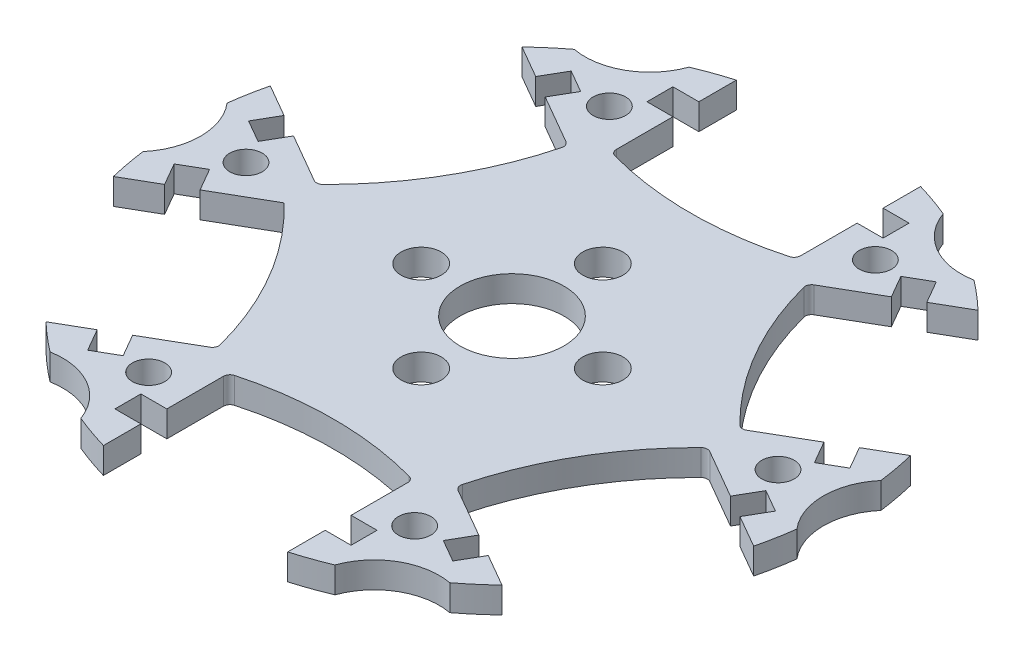
from build123d import *

# Parameters (mm, degrees)
SKETCH_1_R          = 25.4
SKETCH_1_R_2        = 4
EXTRUDE_1_DEPTH     = 2
CUT_EXTRUDE_1_DEPTH = 36.9766591
SKETCH_3_R          = 1.25
SKETCH_3_R_2        = 5
CUT_EXTRUDE_2_DEPTH = 36.269108296
FILLET_1_R          = 0.5
SKETCH_4_R          = 1.55
CUT_EXTRUDE_3_DEPTH = 36.119904794
SKETCH_5_W          = 18.2
SKETCH_5_H          = 2
CUT_EXTRUDE_4_DEPTH = 2


with BuildPart() as part:
    # 草图1 → 凸台-拉伸1 (new body)
    with BuildSketch(Plane(origin=(0, 0, 0), x_dir=(1, 0, 0), z_dir=(0, 1, 0))):
        with Locations(Location((0, 0, 0), (0, 0, 270))):
            Circle(SKETCH_1_R)
        with Locations(Location((0, 0, 0), (0, 0, 270))):
            Circle(SKETCH_1_R_2, mode=Mode.SUBTRACT)
    extrude(amount=EXTRUDE_1_DEPTH)

    # 草图2 → 切除-拉伸1 (cut, through all)
    with BuildSketch(Plane(origin=(0, 2, 0), x_dir=(1, 0, 0), z_dir=(0, 1, 0))):
        with BuildLine():
            Line((-7.1, 24.387496797), (-7.1, 14.762503203))
            ThreePointArc((-7.1, 14.762503203), (0, 13.75), (7.1, 14.762503203))
            Line((7.1, 14.762503203), (7.1, 24.387496797))
            ThreePointArc((7.1, 24.387496797), (0, 25.4), (-7.1, 24.387496797))
        make_face()
        with BuildLine():
            Line((17.57019176, 18.342528765), (9.234702798, 13.530031969))
            ThreePointArc((9.234702798, 13.530031969), (11.907849302, 6.875), (16.334702798, 1.232471235))
            Line((16.334702798, 1.232471235), (24.67019176, 6.044968031))
            ThreePointArc((24.67019176, 6.044968031), (21.997045256, 12.7), (17.57019176, 18.342528765))
        make_face()
        with BuildLine():
            Line((24.67019176, -6.044968031), (16.334702798, -1.232471235))
            ThreePointArc((16.334702798, -1.232471235), (11.907849302, -6.875), (9.234702798, -13.530031969))
            Line((9.234702798, -13.530031969), (17.57019176, -18.342528765))
            ThreePointArc((17.57019176, -18.342528765), (21.997045256, -12.7), (24.67019176, -6.044968031))
        make_face()
        with BuildLine():
            Line((7.1, -24.387496797), (7.1, -14.762503203))
            ThreePointArc((7.1, -14.762503203), (0, -13.75), (-7.1, -14.762503203))
            Line((-7.1, -14.762503203), (-7.1, -24.387496797))
            ThreePointArc((-7.1, -24.387496797), (0, -25.4), (7.1, -24.387496797))
        make_face()
        with BuildLine():
            Line((-17.57019176, -18.342528765), (-9.234702798, -13.530031969))
            ThreePointArc((-9.234702798, -13.530031969), (-11.907849302, -6.875), (-16.334702798, -1.232471235))
            Line((-16.334702798, -1.232471235), (-24.67019176, -6.044968031))
            ThreePointArc((-24.67019176, -6.044968031), (-21.997045256, -12.7), (-17.57019176, -18.342528765))
        make_face()
        with BuildLine():
            Line((-24.67019176, 6.044968031), (-16.334702798, 1.232471235))
            ThreePointArc((-16.334702798, 1.232471235), (-11.907849302, 6.875), (-9.234702798, 13.530031969))
            Line((-9.234702798, 13.530031969), (-17.57019176, 18.342528765))
            ThreePointArc((-17.57019176, 18.342528765), (-21.997045256, 12.7), (-24.67019176, 6.044968031))
        make_face()
    extrude(amount=-CUT_EXTRUDE_1_DEPTH, mode=Mode.SUBTRACT)

    # 草图3 → 切除-拉伸2 (cut, through all)
    with BuildSketch(Plane(origin=(0, 2, 0), x_dir=(1, 0, 0), z_dir=(0, 1, 0))):
        with Locations(Location((-10.25, 17.753520778, 0), (0, 0, 270))):
            Circle(SKETCH_3_R)
        with Locations(Location((10.25, 17.753520778, 0), (0, 0, 270))):
            Circle(SKETCH_3_R)
        with Locations(Location((20.5, 0, 0), (0, 0, 270))):
            Circle(SKETCH_3_R)
        with Locations(Location((10.25, -17.753520778, 0), (0, 0, 270))):
            Circle(SKETCH_3_R)
        with Locations(Location((-10.25, -17.753520778, 0), (0, 0, 270))):
            Circle(SKETCH_3_R)
        with Locations(Location((-20.5, 0, 0), (0, 0, 270))):
            Circle(SKETCH_3_R)
        with Locations((-29, 0)):
            Circle(SKETCH_3_R_2)
        with Locations((-14.5, 25.11473671)):
            Circle(SKETCH_3_R_2)
        with Locations((14.5, 25.11473671)):
            Circle(SKETCH_3_R_2)
        with Locations((29, 0)):
            Circle(SKETCH_3_R_2)
        with Locations((14.5, -25.11473671)):
            Circle(SKETCH_3_R_2)
        with Locations((-14.5, -25.11473671)):
            Circle(SKETCH_3_R_2)
    extrude(amount=-CUT_EXTRUDE_2_DEPTH, mode=Mode.SUBTRACT)

    # 圆角1
    fillet_1_edges = [part.edges().sort_by_distance(p)[0] for p in [
        (16.334702798, 1, -1.232471235),
        (9.234702798, 1, -13.530031969),
        (9.234702798, 1, 13.530031969),
        (16.334702798, 1, 1.232471235),
        (-7.1, 1, 14.762503203),
        (7.1, 1, 14.762503203),
        (-9.234702798, 1, 13.530031969),
        (-9.234702798, 1, -13.530031969),
        (-16.334702798, 1, -1.232471235),
        (7.1, 1, -14.762503203),
        (-7.1, 1, -14.762503203),
    ]]
    fillet(fillet_1_edges, radius=FILLET_1_R)

    # 草图4 → 切除-拉伸3 (cut, through all)
    with BuildSketch(Plane(origin=(0, 2, 0), x_dir=(1, 0, 0), z_dir=(0, 1, 0))):
        with Locations(Location((-7, 0, 0), (0, 0, 270))):
            Circle(SKETCH_4_R)
        with Locations(Location((0, 7, 0), (0, 0, 270))):
            Circle(SKETCH_4_R)
        with Locations(Location((7, 0, 0), (0, 0, 270))):
            Circle(SKETCH_4_R)
        with Locations(Location((0, -7, 0), (0, 0, 270))):
            Circle(SKETCH_4_R)
    extrude(amount=-CUT_EXTRUDE_3_DEPTH, mode=Mode.SUBTRACT)

    # 草图5 → 切除-拉伸4 (cut)
    with BuildSketch(Plane(origin=(0, 2, 0), x_dir=(1, 0, 0), z_dir=(0, 1, 0))):
        Polygon((-12.337495374, -17.630831174), (-21.437495374, -1.869168826), (-23.169546181, -2.869168826), (-14.069546181, -18.630831174), align=None)
        Polygon((-14.069546181, 18.630831174), (-12.337495374, 17.630831174), (-21.437495374, 1.869168826), (-23.169546181, 2.869168826), align=None)
        with Locations((0, 20.5)):
            Rectangle(SKETCH_5_W, SKETCH_5_H)
        Polygon((23.169546181, 2.869168826), (21.437495374, 1.869168826), (12.337495374, 17.630831174), (14.069546181, 18.630831174), align=None)
        Polygon((14.069546181, -18.630831174), (12.337495374, -17.630831174), (21.437495374, -1.869168826), (23.169546181, -2.869168826), align=None)
        with Locations((0, -20.5)):
            Rectangle(SKETCH_5_W, SKETCH_5_H)
    extrude(amount=-CUT_EXTRUDE_4_DEPTH, mode=Mode.SUBTRACT)


solid = part.part
